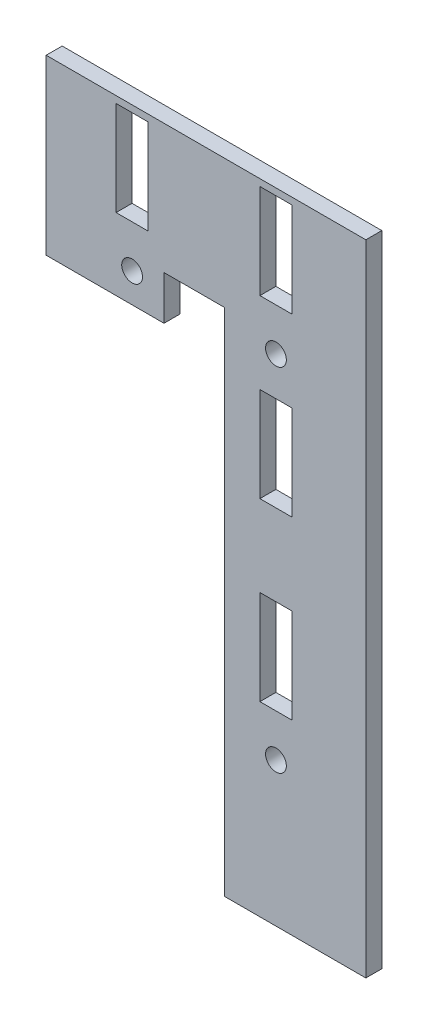
from build123d import *

# Parameters (mm, degrees)
SKETCH1_W           = 101.6
SKETCH1_H           = 50.8
BOSS_EXTRUDE1_DEPTH = 2.54
SKETCH2_R           = 1.651
CUT_EXTRUDE1_DEPTH  = 57.852894385
SKETCH3_W           = 5.1
SKETCH3_H           = 15.02
CUT_EXTRUDE4_DEPTH  = 57.852894385
CUT_EXTRUDE5_DEPTH  = 57.852894385


with BuildPart() as part:
    # Sketch1 → Boss-Extrude1 (new body)
    with BuildSketch(Plane(origin=(0, 0, 0), x_dir=(0, 1, 0), z_dir=(0, 0, 1))):
        Rectangle(SKETCH1_W, SKETCH1_H)
    extrude(amount=BOSS_EXTRUDE1_DEPTH)

    # Sketch2 → Cut-Extrude1 (cut, through all)
    with BuildSketch(Plane.XY.offset(2.54)):
        with Locations((11.115903034, 27.94)):
            Circle(SKETCH2_R)
        with Locations((11.115903034, -27.94)):
            Circle(SKETCH2_R)
        with Locations((-11.744096966, 27.94)):
            Circle(SKETCH2_R)
    extrude(amount=-CUT_EXTRUDE1_DEPTH, mode=Mode.SUBTRACT)

    # Sketch3 → Cut-Extrude4 (cut, through all)
    with BuildSketch(Plane.XY.offset(2.54)):
        with Locations((11.115903034, -13.67)):
            Rectangle(SKETCH3_W, SKETCH3_H)
        with Locations((11.115903034, 14.27)):
            Rectangle(SKETCH3_W, SKETCH3_H)
        with Locations((11.115903034, 42.21)):
            Rectangle(SKETCH3_W, SKETCH3_H)
        with Locations((-11.744096966, 42.21)):
            Rectangle(SKETCH3_W, SKETCH3_H)
    extrude(amount=-CUT_EXTRUDE4_DEPTH, mode=Mode.SUBTRACT)

    # Sketch5 → Cut-Extrude5 (cut, through all)
    with BuildSketch(Plane.XY.offset(2.54)):
        Polygon((2.977903034, -50.8), (2.977903034, 30.255), (-6.674096966, 30.255), (-6.674096966, 23.27), (-25.4, 23.27), (-25.4, -50.8), align=None)
    extrude(amount=-CUT_EXTRUDE5_DEPTH, mode=Mode.SUBTRACT)


solid = part.part
